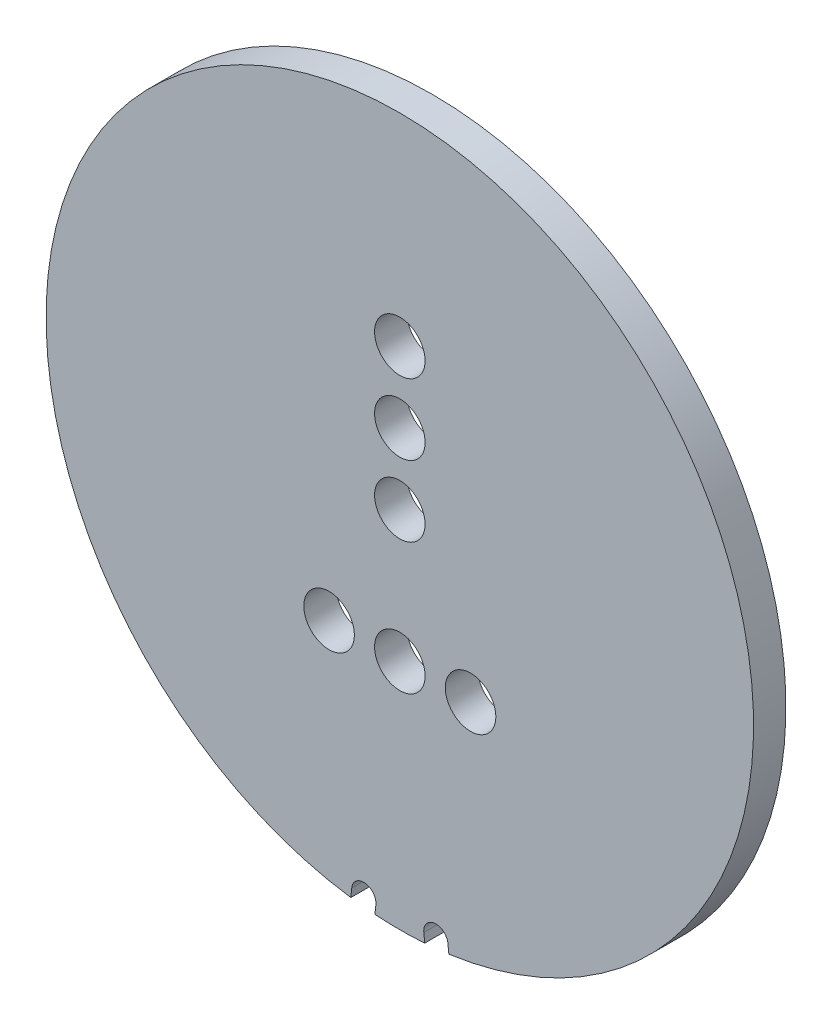
from build123d import *

# Parameters (mm, degrees)
SKETCH1_R           = 17.5
BOSS_EXTRUDE1_DEPTH = 1.6
CUT_EXTRUDE1_DEPTH  = 25.800403223
SKETCH4_R           = 1.25
CUT_EXTRUDE2_DEPTH  = 25.800403223


with BuildPart() as part:
    # Sketch1 → Boss-Extrude1 (new body)
    with BuildSketch(Plane(origin=(0, 0, -930.4), x_dir=(-1, 0, 0), z_dir=(0, 0, -1))):
        Circle(SKETCH1_R)
    extrude(amount=BOSS_EXTRUDE1_DEPTH)

    # Sketch2 → Cut-Extrude1 (cut, through all)
    with BuildSketch(Plane(origin=(0, 0, -932), x_dir=(-1, 0, 0), z_dir=(0, 0, -1))):
        with BuildLine():
            Line((-2.378923436, -16.893881238), (-2.424885778, -17.331183715))
            ThreePointArc((-2.424885778, -17.331183715), (-1.829248107, -17.404133169), (-1.231459504, -17.456617871))
            Line((-1.231459504, -17.456617871), (-1.185497161, -17.019315394))
            ThreePointArc((-1.185497161, -17.019315394), (-1.719493221, -16.359885179), (-2.378923436, -16.893881238))
        make_face()
        with BuildLine():
            ThreePointArc((1.231459504, -17.456617871), (1.829248107, -17.404133169), (2.424885778, -17.331183715))
            Line((2.424885778, -17.331183715), (2.378923436, -16.893881238))
            ThreePointArc((2.378923436, -16.893881238), (1.719493221, -16.359885179), (1.185497161, -17.019315394))
            Line((1.185497161, -17.019315394), (1.231459504, -17.456617871))
        make_face()
    extrude(amount=-CUT_EXTRUDE1_DEPTH, mode=Mode.SUBTRACT)

    # Sketch4 → Cut-Extrude2 (cut, through all)
    with BuildSketch(Plane.XY.offset(-930.4)):
        with Locations((0, 7.5)):
            Circle(SKETCH4_R)
        with Locations((0, 4)):
            Circle(SKETCH4_R)
        with Locations((0, 0.5)):
            Circle(SKETCH4_R)
        with Locations((-3.5, -6)):
            Circle(SKETCH4_R)
        with Locations((0, -6)):
            Circle(SKETCH4_R)
        with Locations((3.5, -6)):
            Circle(SKETCH4_R)
    extrude(amount=-CUT_EXTRUDE2_DEPTH, mode=Mode.SUBTRACT)


solid = part.part
